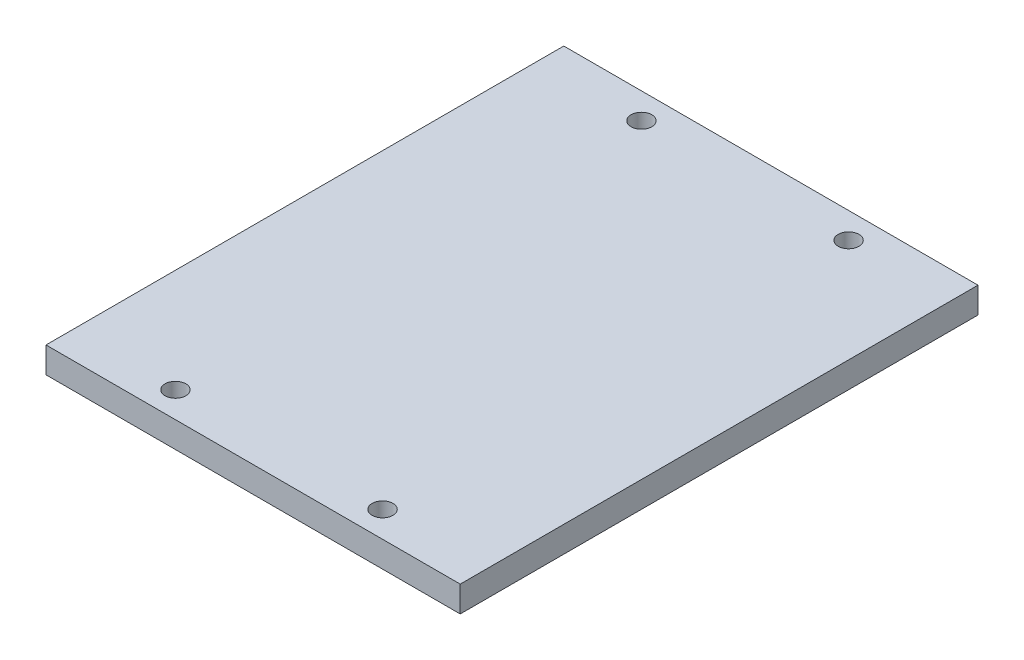
from build123d import *

# Parameters (mm, degrees)
SKETCH1_W           = 101.6
SKETCH1_H           = 127
BOSS_EXTRUDE1_DEPTH = 6.35
SKETCH3_R           = 2.5527
CUT_EXTRUDE2_DEPTH  = 9.525


with BuildPart() as part:
    # Sketch1 → Boss-Extrude1 (new body)
    with BuildSketch(Plane(origin=(0, 0, 0), x_dir=(1, 0, 0), z_dir=(0, 1, 0))):
        Rectangle(SKETCH1_W, SKETCH1_H)
    extrude(amount=BOSS_EXTRUDE1_DEPTH)

    # Sketch3 → Cut-Extrude2 (cut)
    with BuildSketch(Plane(origin=(0, 6.35, 0), x_dir=(1, 0, 0), z_dir=(0, 1, 0))):
        with Locations(Location((-25.4, 57.15, 0), (0, 0, 270))):
            Circle(SKETCH3_R)
        with Locations(Location((-25.4, -57.15, 0), (0, 0, 270))):
            Circle(SKETCH3_R)
        with Locations(Location((25.4, -57.15, 0), (0, 0, 270))):
            Circle(SKETCH3_R)
        with Locations(Location((25.4, 57.15, 0), (0, 0, 270))):
            Circle(SKETCH3_R)
    extrude(amount=-CUT_EXTRUDE2_DEPTH, mode=Mode.SUBTRACT)


solid = part.part
